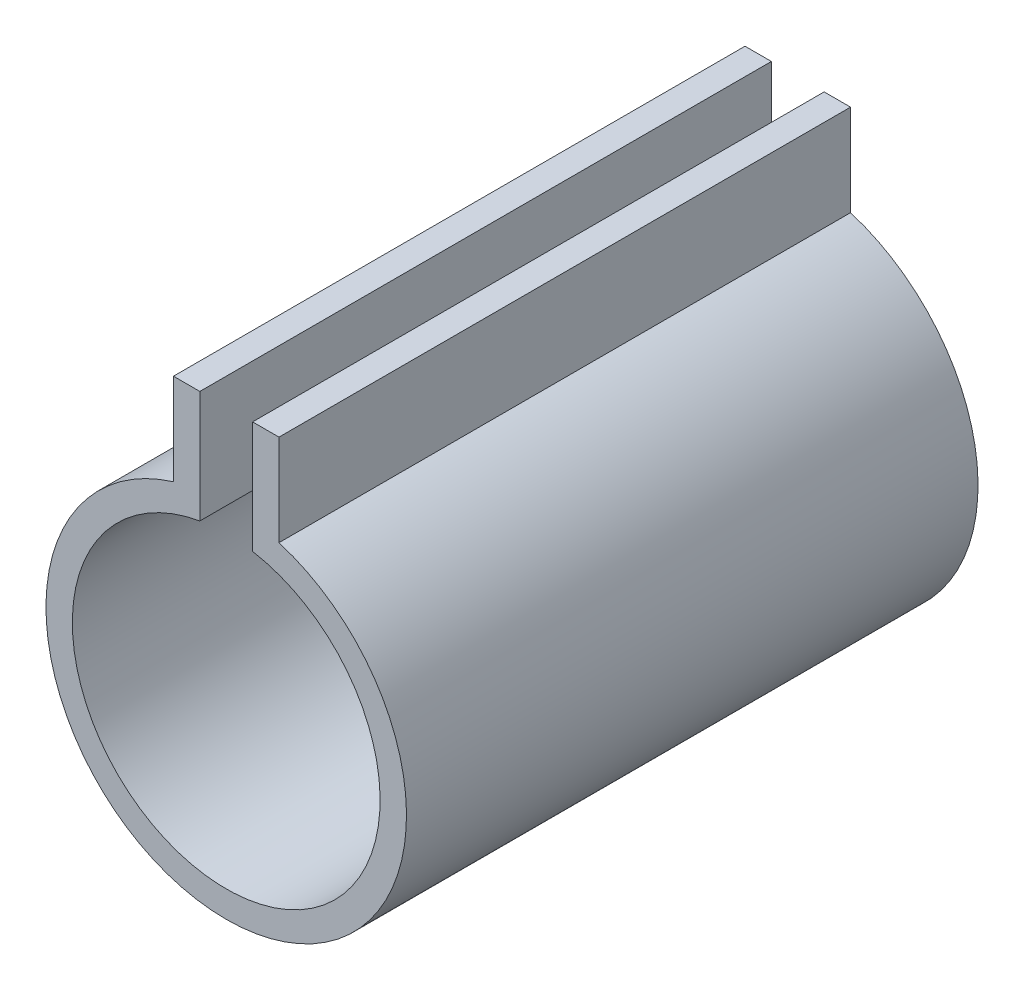
from build123d import *

# Parameters (mm, degrees)
BOSS_EXTRUDE1_DEPTH = 65


with BuildPart() as part:
    # Sketch1 → Boss-Extrude1 (new body)
    with BuildSketch(Plane.XY):
        with BuildLine():
            Line((3, 17.24093965), (3, 30))
            Line((3, 30), (6, 30))
            Line((6, 30), (6, 19.602295784))
            ThreePointArc((6, 19.602295784), (0, -20.5), (-6, 19.602295784))
            Line((-6, 19.602295784), (-6, 30))
            Line((-6, 30), (-3, 30))
            Line((-3, 30), (-3, 17.24093965))
            ThreePointArc((-3, 17.24093965), (0, -17.5), (3, 17.24093965))
        make_face()
    extrude(amount=BOSS_EXTRUDE1_DEPTH)


solid = part.part
